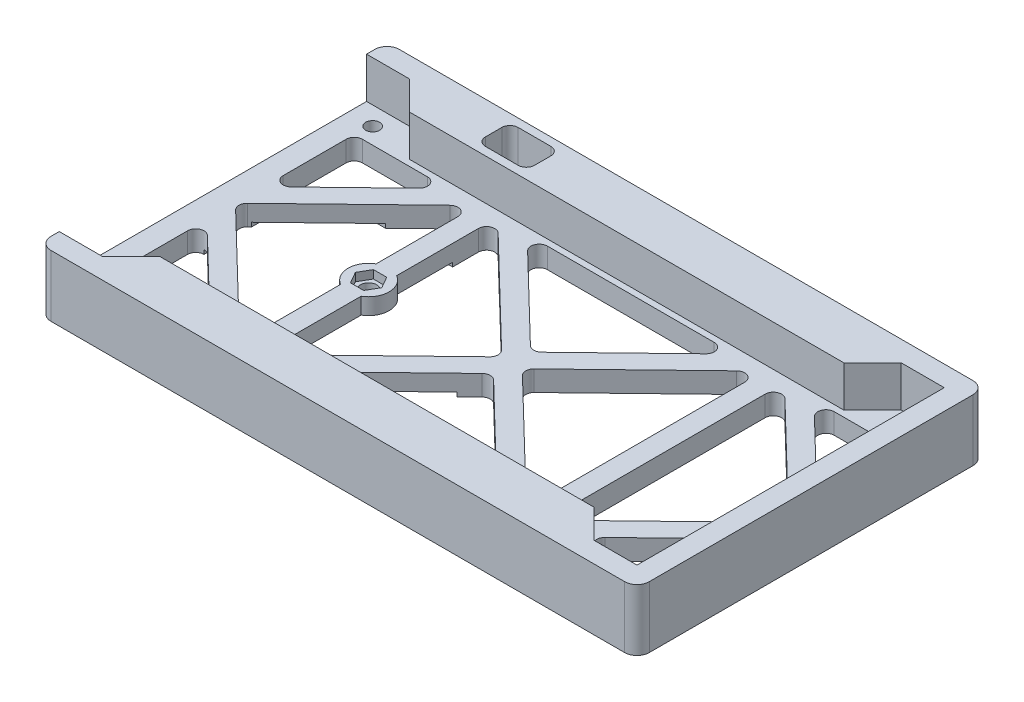
from build123d import *

# Parameters (mm, degrees)
SKETCH1_W                                       = 146
SKETCH1_H                                       = 85
BOSS_EXTRUDE1_DEPTH                             = 15
SHELL1_T                                        = -5
SKETCH2_W                                       = 5
SKETCH2_H                                       = 75
CUT_EXTRUDE1_DEPTH                              = 10
BOSS_EXTRUDE2_DEPTH                             = 10
CSK_FOR_M3_FLAT_HEAD_MACHINE_SCREW1_D           = 3.4
CSK_FOR_M3_FLAT_HEAD_MACHINE_SCREW1_DEPTH       = 10
CSK_FOR_M3_FLAT_HEAD_MACHINE_SCREW1_CSINK_D     = 6.3
CSK_FOR_M3_FLAT_HEAD_MACHINE_SCREW1_CSINK_ANGLE = 90
CSK_FOR_M3_FLAT_HEAD_MACHINE_SCREW1_TIP         = 1.021463052
FILLET1_R                                       = 3
CUT_EXTRUDE3_DEPTH                              = 10
FILLET2_R                                       = 2
SKETCH13_W                                      = 12
SKETCH13_H                                      = 8
CUT_EXTRUDE5_DEPTH                              = 86.791899384
FILLET3_R                                       = 2
SKETCH14_R                                      = 5
BOSS_EXTRUDE4_DEPTH                             = 5
F_4_0_4_DIAMETER_HOLE2_D                        = 4
CUT_EXTRUDE6_DEPTH                              = 2
SKETCH19_W                                      = 61
SKETCH19_H                                      = 36
CUT_EXTRUDE7_DEPTH                              = 1


with BuildPart() as part:
    # Sketch1 → Boss-Extrude1 (new body)
    with BuildSketch(Plane(origin=(0, 0, 0), x_dir=(1, 0, 0), z_dir=(0, 1, 0))):
        Rectangle(SKETCH1_W, SKETCH1_H)
    extrude(amount=BOSS_EXTRUDE1_DEPTH)

    # Shell1
    shell1_openings = [part.faces().sort_by_distance(p)[0] for p in [
        (0, 15, 0),
    ]]
    offset(amount=SHELL1_T, openings=shell1_openings, kind=Kind.INTERSECTION)

    # Sketch2 → Cut-Extrude1 (cut)
    with BuildSketch(Plane(origin=(0, 15, 0), x_dir=(1, 0, 0), z_dir=(0, 1, 0))):
        with Locations((-70.5, 0)):
            Rectangle(SKETCH2_W, SKETCH2_H)
    extrude(amount=-CUT_EXTRUDE1_DEPTH, mode=Mode.SUBTRACT)

    # Sketch3 → Boss-Extrude2 (add)
    with BuildSketch(Plane(origin=(0, 5, 0), x_dir=(1, 0, 0), z_dir=(0, 1, 0))):
        Polygon((-55.5, 30.5), (50.5, 30.5), (57.5, 37.5), (-62.5, 37.5), align=None)
        Polygon((-55.5, -30.5), (-62.5, -37.5), (57.5, -37.5), (50.5, -30.5), align=None)
    extrude(amount=BOSS_EXTRUDE2_DEPTH)

    # CSK for M3 Flat Head Machine Screw1
    with Locations(Plane(origin=(0, 0, 0), x_dir=(-1, 0, 0), z_dir=(0, -1, 0))):
        with Locations((-63, -33), (67, 33), (67, -33), (-63, 33)):
            CounterSinkHole(CSK_FOR_M3_FLAT_HEAD_MACHINE_SCREW1_D / 2, CSK_FOR_M3_FLAT_HEAD_MACHINE_SCREW1_CSINK_D / 2, depth=CSK_FOR_M3_FLAT_HEAD_MACHINE_SCREW1_DEPTH, counter_sink_angle=CSK_FOR_M3_FLAT_HEAD_MACHINE_SCREW1_CSINK_ANGLE)
            with Locations((0, 0, -(CSK_FOR_M3_FLAT_HEAD_MACHINE_SCREW1_DEPTH + CSK_FOR_M3_FLAT_HEAD_MACHINE_SCREW1_TIP / 2))):  # 118° drill point
                Cone(0, CSK_FOR_M3_FLAT_HEAD_MACHINE_SCREW1_D / 2, CSK_FOR_M3_FLAT_HEAD_MACHINE_SCREW1_TIP, mode=Mode.SUBTRACT)

    # Fillet1
    fillet1_edges = [part.edges().sort_by_distance(p)[0] for p in [
        (-73, 7.5, -42.5),
        (73, 7.5, -42.5),
        (73, 7.5, 42.5),
        (-73, 7.5, 42.5),
    ]]
    fillet(fillet1_edges, radius=FILLET1_R)

    # Sketch8 → Cut-Extrude3 (cut)
    with BuildSketch(Plane.XZ):
        Polygon((67.5, 0), (37.5, 29), (37.5, -29), align=None)
        Polygon((0, 4.537548682), (25.305984122, 29), (-25.305984122, 29), align=None)
        Polygon((2.5, 0), (32.5, -29), (32.5, 29), align=None)
        Polygon((-2.5, 0), (-32.5, 29), (-32.5, -29), align=None)
        Polygon((-67.5, 0), (-37.5, -29), (-37.5, 29), align=None)
        Polygon((-44.694015878, 29), (-67.5, 29), (-67.5, 6.954215348), align=None)
        Polygon((67.5, 6.954215348), (44.694015878, 29), (67.5, 29), align=None)
        Polygon((44.694015878, -29), (67.5, -29), (67.5, -6.954215348), align=None)
        Polygon((-67.5, -6.954215348), (-44.694015878, -29), (-67.5, -29), align=None)
        Polygon((-25.305984122, -29), (25.305984122, -29), (0, -4.537548682), align=None)
    extrude(amount=-CUT_EXTRUDE3_DEPTH, mode=Mode.SUBTRACT)

    # Fillet2
    fillet2_edges = [part.edges().sort_by_distance(p)[0] for p in [
        (-67.5, 2.5, 0),
        (-37.5, 2.5, 29),
        (-37.5, 2.5, -29),
        (0, 2.5, 4.537548682),
        (-25.305984122, 2.5, 29),
        (25.305984122, 2.5, 29),
        (44.694015878, 2.5, -29),
        (67.5, 2.5, -6.954215348),
        (67.5, 2.5, -29),
        (-67.5, 2.5, -29),
        (-67.5, 2.5, -6.954215348),
        (-44.694015878, 2.5, -29),
        (67.5, 2.5, 29),
        (67.5, 2.5, 6.954215348),
        (44.694015878, 2.5, 29),
        (-44.694015878, 2.5, 29),
        (-67.5, 2.5, 6.954215348),
        (-67.5, 2.5, 29),
        (-2.5, 2.5, 0),
        (-32.5, 2.5, -29),
        (-32.5, 2.5, 29),
        (2.5, 2.5, 0),
        (32.5, 2.5, 29),
        (32.5, 2.5, -29),
        (-25.305984122, 2.5, -29),
        (0, 2.5, -4.537548682),
        (25.305984122, 2.5, -29),
        (67.5, 2.5, 0),
        (37.5, 2.5, -29),
        (37.5, 2.5, 29),
    ]]
    fillet(fillet2_edges, radius=FILLET2_R)

    # Sketch13 → Cut-Extrude5 (cut, through all)
    with BuildSketch(Plane.XZ):
        with Locations((-35, -36.5)):
            Rectangle(SKETCH13_W, SKETCH13_H)
    extrude(amount=-CUT_EXTRUDE5_DEPTH, mode=Mode.SUBTRACT)

    # Fillet3
    fillet3_edges = [part.edges().sort_by_distance(p)[0] for p in [
        (-41, 7.5, -40.5),
        (-41, 7.5, -32.5),
        (-29, 7.5, -32.5),
        (-29, 7.5, -40.5),
    ]]
    fillet(fillet3_edges, radius=FILLET3_R)

    # Sketch14 → Boss-Extrude4 (add, through all)
    with BuildSketch(Plane(origin=(0, 5, 0), x_dir=(1, 0, 0), z_dir=(0, 1, 0))):
        with Locations((-35, 0)):
            Circle(SKETCH14_R)
    extrude(amount=-BOSS_EXTRUDE4_DEPTH)

    # Ø4.0 (4) Diameter Hole2 (through all)
    with Locations(Plane(origin=(0, 5, 0), x_dir=(1, 0, 0), z_dir=(0, 1, 0))):
        with Locations((-35, 0)):
            Hole(F_4_0_4_DIAMETER_HOLE2_D / 2)

    # Sketch17 → Cut-Extrude6 (cut)
    with BuildSketch(Plane(origin=(0, 5, 0), x_dir=(1, 0, 0), z_dir=(0, 1, 0))):
        Polygon((-31.766838493, 0), (-33.383419246, 2.8), (-36.616580754, 2.8), (-38.233161507, 0), (-36.616580754, -2.8), (-33.383419246, -2.8), align=None)
    extrude(amount=-CUT_EXTRUDE6_DEPTH, mode=Mode.SUBTRACT)

    # Sketch19 → Cut-Extrude7 (cut)
    with BuildSketch(Plane.XZ):
        with Locations((-35, 0)):
            Rectangle(SKETCH19_W, SKETCH19_H)
    extrude(amount=-CUT_EXTRUDE7_DEPTH, mode=Mode.SUBTRACT)


solid = part.part
